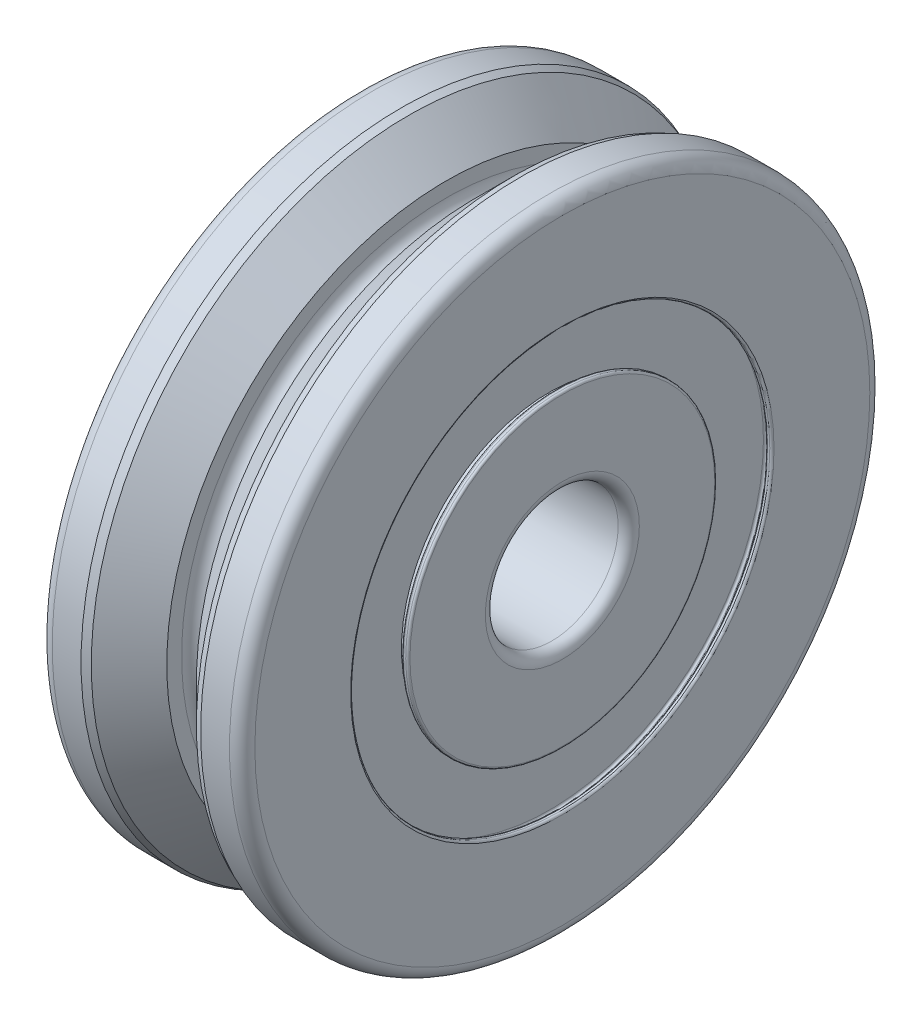
from build123d import *


with BuildPart() as part:
    # Sketch1 → Revolve1 (revolve)
    with BuildSketch(Plane.XY, mode=Mode.PRIVATE) as revolve1_sk:
        with BuildLine():
            Line((-4.8641, 7.3152), (-4.8641, 3.6957))
            ThreePointArc((-4.8641, 3.6957), (-4.715310245, 3.336489755), (-4.3561, 3.1877))
            Line((-4.3561, 3.1877), (4.3561, 3.1877))
            ThreePointArc((4.3561, 3.1877), (4.715310245, 3.336489755), (4.8641, 3.6957))
            Line((4.8641, 3.6957), (4.8641, 7.3152))
            ThreePointArc((4.8641, 7.3152), (4.834342049, 7.387042049), (4.7625, 7.4168))
            Line((4.7625, 7.4168), (4.6609, 7.4168))
            ThreePointArc((4.6609, 7.4168), (4.589057951, 7.387042049), (4.5593, 7.3152))
            Line((4.5593, 7.3152), (4.5593, 7.112))
            Line((4.5593, 7.112), (4.2545, 7.112))
            Line((4.2545, 7.112), (4.2545, 10.2616))
            ThreePointArc((4.2545, 10.2616), (4.284257951, 10.333442049), (4.3561, 10.3632))
            Line((4.3561, 10.3632), (4.5593, 10.3632))
            Line((4.5593, 10.3632), (4.5593, 10.16))
            ThreePointArc((4.5593, 10.16), (4.589057951, 10.088157951), (4.6609, 10.0584))
            Line((4.6609, 10.0584), (4.7625, 10.0584))
            ThreePointArc((4.7625, 10.0584), (4.834342049, 10.088157951), (4.8641, 10.16))
            Line((4.8641, 10.16), (4.8641, 14.7574))
            ThreePointArc((4.8641, 14.7574), (4.685552294, 15.188452294), (4.2545, 15.367))
            Line((4.2545, 15.367), (2.86990403, 15.367))
            Line((2.86990403, 15.367), (2.523019932, 15.223315903))
            Line((2.523019932, 15.223315903), (0.7112, 13.411495971))
            Line((0.7112, 13.411495971), (0.7112, 12.700000025))
            ThreePointArc((0.7112, 12.700000025), (0, 11.988800025), (-0.7112, 12.700000025))
            Line((-0.7112, 12.700000025), (-0.7112, 13.411495971))
            Line((-0.7112, 13.411495971), (-2.523019932, 15.223315903))
            Line((-2.523019932, 15.223315903), (-2.86990403, 15.367))
            Line((-2.86990403, 15.367), (-4.2545, 15.367))
            ThreePointArc((-4.2545, 15.367), (-4.685552294, 15.188452294), (-4.8641, 14.7574))
            Line((-4.8641, 14.7574), (-4.8641, 10.16))
            ThreePointArc((-4.8641, 10.16), (-4.834342049, 10.088157951), (-4.7625, 10.0584))
            Line((-4.7625, 10.0584), (-4.6609, 10.0584))
            ThreePointArc((-4.6609, 10.0584), (-4.589057951, 10.088157951), (-4.5593, 10.16))
            Line((-4.5593, 10.16), (-4.5593, 10.3632))
            Line((-4.5593, 10.3632), (-4.3561, 10.3632))
            ThreePointArc((-4.3561, 10.3632), (-4.284257951, 10.333442049), (-4.2545, 10.2616))
            Line((-4.2545, 10.2616), (-4.2545, 7.112))
            Line((-4.2545, 7.112), (-4.5593, 7.112))
            Line((-4.5593, 7.112), (-4.5593, 7.3152))
            ThreePointArc((-4.5593, 7.3152), (-4.589057951, 7.387042049), (-4.6609, 7.4168))
            Line((-4.6609, 7.4168), (-4.7625, 7.4168))
            ThreePointArc((-4.7625, 7.4168), (-4.834342049, 7.387042049), (-4.8641, 7.3152))
        make_face()
    revolve(revolve1_sk.sketch.rotate(Axis((-4.8641, 0, 0), (1, 0, 0)), 270), axis=Axis((-4.8641, 0, 0), (1, 0, 0)))


solid = part.part
